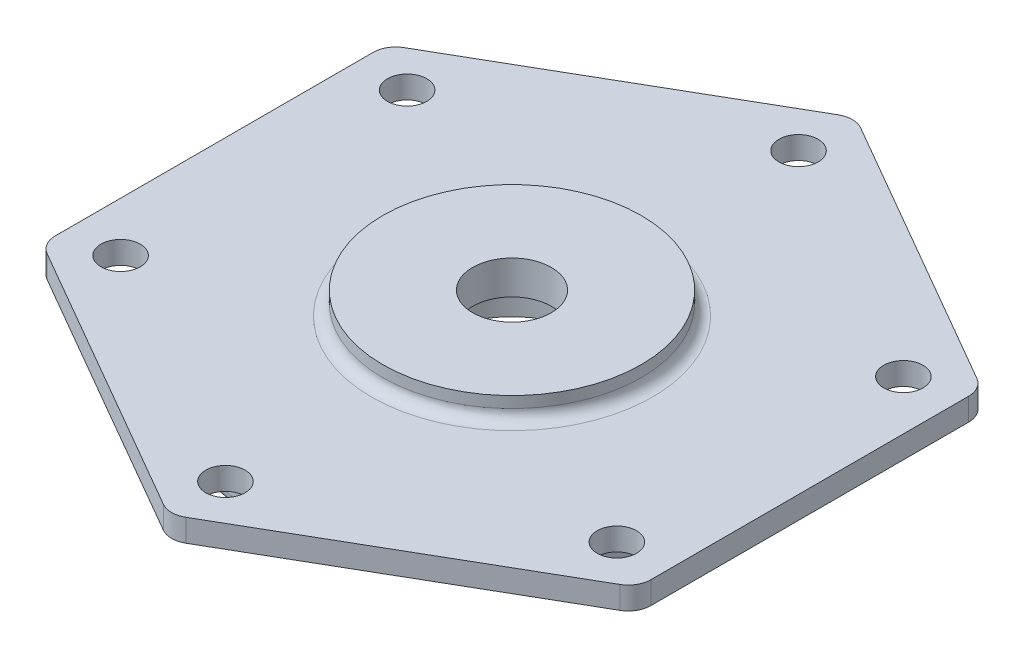
from build123d import *

# Parameters (mm, degrees)
BOSS_EXTRUDE1_DEPTH = 4
SKETCH2_R           = 23
BOSS_EXTRUDE2_DEPTH = 4
SKETCH3_R           = 45
BOSS_EXTRUDE3_DEPTH = 6
SKETCH4_R           = 40
SKETCH4_R_2         = 19
CUT_EXTRUDE1_DEPTH  = 6
SKETCH5_R           = 14
CUT_EXTRUDE2_DEPTH  = 8
SKETCH6_R           = 7
CUT_EXTRUDE3_DEPTH  = 81.888663881
FILLET1_R           = 2
FILLET2_R           = 2
FILLET3_R           = 2
SKETCH7_R           = 3.5
CUT_EXTRUDE4_DEPTH  = 82.110886719


with BuildPart() as part:
    # Sketch1 → Boss-Extrude1 (new body)
    with BuildSketch(Plane(origin=(0, 0, 0), x_dir=(1, 0, 0), z_dir=(0, 1, 0))):
        with BuildLine():
            Line((2, -60.044427996), (51, -31.754264805))
            ThreePointArc((51, -31.754264805), (52.464101615, -30.29016319), (53, -28.29016319))
            Line((53, -28.29016319), (53, 28.29016319))
            ThreePointArc((53, 28.29016319), (52.464101615, 30.29016319), (51, 31.754264805))
            Line((51, 31.754264805), (2, 60.044427996))
            ThreePointArc((2, 60.044427996), (0, 60.580326381), (-2, 60.044427996))
            Line((-2, 60.044427996), (-51, 31.754264805))
            ThreePointArc((-51, 31.754264805), (-52.464101615, 30.29016319), (-53, 28.29016319))
            Line((-53, 28.29016319), (-53, -28.29016319))
            ThreePointArc((-53, -28.29016319), (-52.464101615, -30.29016319), (-51, -31.754264805))
            Line((-51, -31.754264805), (-2, -60.044427996))
            ThreePointArc((-2, -60.044427996), (0, -60.580326381), (2, -60.044427996))
        make_face()
    extrude(amount=BOSS_EXTRUDE1_DEPTH)

    # Sketch2 → Boss-Extrude2 (add)
    with BuildSketch(Plane(origin=(0, 4, 0), x_dir=(1, 0, 0), z_dir=(0, 1, 0))):
        with Locations(Location((0, 0, 0), (0, 0, 270))):
            Circle(SKETCH2_R)
    extrude(amount=BOSS_EXTRUDE2_DEPTH)

    # Sketch3 → Boss-Extrude3 (add)
    with BuildSketch(Plane.XZ):
        with Locations(Location((0, 0, 0), (0, 0, 270))):
            Circle(SKETCH3_R)
    extrude(amount=BOSS_EXTRUDE3_DEPTH)

    # Sketch4 → Cut-Extrude1 (cut)
    with BuildSketch(Plane.XZ.offset(6)):
        with Locations(Location((0, 0, 0), (0, 0, 270))):
            Circle(SKETCH4_R)
        with Locations(Location((1.215957684, 0, 0), (0, 0, 270))):
            Circle(SKETCH4_R_2, mode=Mode.SUBTRACT)
    extrude(amount=-CUT_EXTRUDE1_DEPTH, mode=Mode.SUBTRACT)

    # Sketch5 → Cut-Extrude2 (cut)
    with BuildSketch(Plane.XZ.offset(6)):
        with Locations(Location((0, 0, 0), (0, 0, 270))):
            Circle(SKETCH5_R)
    extrude(amount=-CUT_EXTRUDE2_DEPTH, mode=Mode.SUBTRACT)

    # Sketch6 → Cut-Extrude3 (cut, through all)
    with BuildSketch(Plane.XZ.offset(-2)):
        with Locations(Location((0, 0, 0), (0, 0, 270))):
            Circle(SKETCH6_R)
    extrude(amount=-CUT_EXTRUDE3_DEPTH, mode=Mode.SUBTRACT)

    # Fillet1
    fillet1_edges = [part.edges().sort_by_distance(p)[0] for p in [
        (1.215957684, -6, 19),
    ]]
    fillet(fillet1_edges, radius=FILLET1_R)

    # Fillet2
    fillet2_edges = [part.edges().sort_by_distance(p)[0] for p in [
        (0, 4, -23),
    ]]
    fillet(fillet2_edges, radius=FILLET2_R)

    # Fillet3
    fillet3_edges = [part.edges().sort_by_distance(p)[0] for p in [
        (0, -6, 45),
    ]]
    fillet(fillet3_edges, radius=FILLET3_R)

    # Sketch7 → Cut-Extrude4 (cut, through all)
    with BuildSketch(Plane(origin=(0, 4, 0), x_dir=(1, 0, 0), z_dir=(0, 1, 0))):
        with Locations(Location((0, 51, 0), (0, 0, 270))):
            Circle(SKETCH7_R)
        with Locations(Location((44.167295593, 25.5, 0), (0, 0, 270))):
            Circle(SKETCH7_R)
        with Locations(Location((44.167295593, -25.5, 0), (0, 0, 270))):
            Circle(SKETCH7_R)
        with Locations(Location((0, -51, 0), (0, 0, 270))):
            Circle(SKETCH7_R)
        with Locations(Location((-44.167295593, -25.5, 0), (0, 0, 270))):
            Circle(SKETCH7_R)
        with Locations(Location((-44.167295593, 25.5, 0), (0, 0, 270))):
            Circle(SKETCH7_R)
    extrude(amount=-CUT_EXTRUDE4_DEPTH, mode=Mode.SUBTRACT)


solid = part.part
